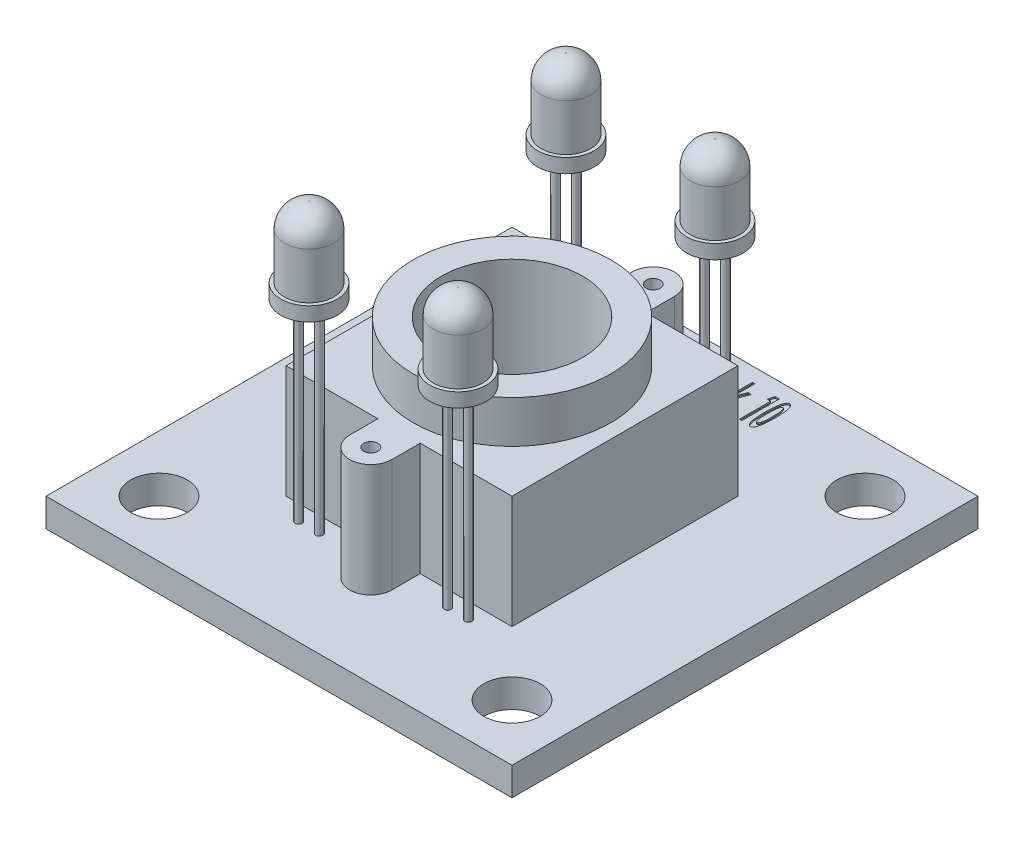
from build123d import *

# Parameters (mm, degrees)
SKETCH1_W            = 33
SKETCH1_H            = 33
BOSS_EXTRUDE1_DEPTH  = 2
SKETCH2_R            = 2
CUT_EXTRUDE1_DEPTH   = 2
BOSS_EXTRUDE2_DEPTH  = 8
SKETCH8_R            = 0.5
CUT_EXTRUDE2_DEPTH   = 5
SKETCH9_R            = 0.25
BOSS_EXTRUDE3_DEPTH  = 14
SKETCH13_R           = 2
BOSS_EXTRUDE6_DEPTH  = 1
SKETCH25_R           = 1.75
BOSS_EXTRUDE7_DEPTH  = 5
FILLET4_R            = 1.7
SKETCH26_R           = 1.75
BOSS_EXTRUDE8_DEPTH  = 5
FILLET5_R            = 1.7
SKETCH27_R           = 1.75
BOSS_EXTRUDE9_DEPTH  = 5
FILLET6_R            = 1.7
SKETCH28_R           = 1.75
BOSS_EXTRUDE10_DEPTH = 5
FILLET7_R            = 1.7
SKETCH29_R           = 7
BOSS_EXTRUDE11_DEPTH = 3
SKETCH30_R           = 5
CUT_EXTRUDE4_DEPTH   = 9
SKETCH31_W           = 0.169604701
SKETCH31_H           = 2.713675214
SKETCH31_W_2         = 0.712339743
SKETCH31_H_2         = 0.169604701
CUT_EXTRUDE5_DEPTH   = 0.1


with BuildPart() as part:
    # Sketch1 → Boss-Extrude1 (new body)
    with BuildSketch(Plane(origin=(0, 0, 0), x_dir=(1, 0, 0), z_dir=(0, 1, 0))):
        with Locations((-19.54163097, 23.680254944)):
            Rectangle(SKETCH1_W, SKETCH1_H)
    extrude(amount=BOSS_EXTRUDE1_DEPTH)

    # Sketch2 → Cut-Extrude1 (cut)
    with BuildSketch(Plane(origin=(0, 2, 0), x_dir=(1, 0, 0), z_dir=(0, 1, 0))):
        with Locations(Location((-32.04163097, 36.180254944, 0), (0, 0, 270))):
            Circle(SKETCH2_R)
        with Locations(Location((-7.04163097, 36.180254944, 0), (0, 0, 270))):
            Circle(SKETCH2_R)
        with Locations(Location((-7.04163097, 11.180254944, 0), (0, 0, 270))):
            Circle(SKETCH2_R)
        with Locations(Location((-32.04163097, 11.180254944, 0), (0, 0, 270))):
            Circle(SKETCH2_R)
    extrude(amount=-CUT_EXTRUDE1_DEPTH, mode=Mode.SUBTRACT)

    # Sketch7 → Boss-Extrude2 (add)
    with BuildSketch(Plane(origin=(0, 2, 0), x_dir=(1, 0, 0), z_dir=(0, 1, 0))):
        with BuildLine():
            Line((-21.04163097, 15.680254944), (-21.04163097, 13.680254944))
            ThreePointArc((-21.04163097, 13.680254944), (-19.54163097, 12.180254944), (-18.04163097, 13.680254944))
            Line((-18.04163097, 13.680254944), (-18.04163097, 15.680254944))
            Line((-18.04163097, 15.680254944), (-11.54163097, 15.680254944))
            Line((-11.54163097, 15.680254944), (-11.54163097, 31.680254944))
            Line((-11.54163097, 31.680254944), (-18.04163097, 31.680254944))
            Line((-18.04163097, 31.680254944), (-18.04163097, 33.680254944))
            ThreePointArc((-18.04163097, 33.680254944), (-19.54163097, 35.180254944), (-21.04163097, 33.680254944))
            Line((-21.04163097, 33.680254944), (-21.04163097, 31.680254944))
            Line((-21.04163097, 31.680254944), (-27.54163097, 31.680254944))
            Line((-27.54163097, 31.680254944), (-27.54163097, 15.680254944))
            Line((-27.54163097, 15.680254944), (-21.04163097, 15.680254944))
        make_face()
    extrude(amount=BOSS_EXTRUDE2_DEPTH)

    # Sketch8 → Cut-Extrude2 (cut)
    with BuildSketch(Plane(origin=(0, 10, 0), x_dir=(1, 0, 0), z_dir=(0, 1, 0))):
        with Locations(Location((-19.54163097, 33.680254944, 0), (0, 0, 270))):
            Circle(SKETCH8_R)
        with Locations(Location((-19.54163097, 13.680254944, 0), (0, 0, 270))):
            Circle(SKETCH8_R)
    extrude(amount=-CUT_EXTRUDE2_DEPTH, mode=Mode.SUBTRACT)

    # Sketch9 → Boss-Extrude3 (add)
    with BuildSketch(Plane(origin=(0, 2, 0), x_dir=(1, 0, 0), z_dir=(0, 1, 0))):
        with Locations(Location((-25.551424168, 32.777236542, 0), (0, 0, 270))):
            Circle(SKETCH9_R)
        with Locations(Location((-24.084586125, 32.777236542, 0), (0, 0, 270))):
            Circle(SKETCH9_R)
        with Locations(Location((-14.998675815, 32.777236542, 0), (0, 0, 90))):
            Circle(SKETCH9_R)
        with Locations(Location((-13.531837771, 32.777236542, 0), (0, 0, 90))):
            Circle(SKETCH9_R)
        with Locations(Location((-24.084586125, 14.583273346, 0), (0, 0, 90))):
            Circle(SKETCH9_R)
        with Locations(Location((-25.551424168, 14.583273346, 0), (0, 0, 90))):
            Circle(SKETCH9_R)
        with Locations(Location((-14.998675815, 14.583273346, 0), (0, 0, 270))):
            Circle(SKETCH9_R)
        with Locations(Location((-13.531837771, 14.583273346, 0), (0, 0, 270))):
            Circle(SKETCH9_R)
    extrude(amount=BOSS_EXTRUDE3_DEPTH)

    # Sketch13 → Boss-Extrude6 (add)
    with BuildSketch(Plane(origin=(0, 16, 0), x_dir=(1, 0, 0), z_dir=(0, 1, 0))):
        with Locations(Location((-14.265256793, 14.583273346, 0), (0, 0, 270))):
            Circle(SKETCH13_R)
        with Locations(Location((-24.818005146, 32.777236542, 0), (0, 0, 270))):
            Circle(SKETCH13_R)
        with Locations(Location((-24.818005146, 14.583273346, 0), (0, 0, 270))):
            Circle(SKETCH13_R)
        with Locations(Location((-14.265256793, 32.777236542, 0), (0, 0, 270))):
            Circle(SKETCH13_R)
    extrude(amount=BOSS_EXTRUDE6_DEPTH)

    # Sketch25 → Boss-Extrude7 (add)
    with BuildSketch(Plane(origin=(0, 17, 0), x_dir=(1, 0, 0), z_dir=(0, 1, 0))):
        with Locations(Location((-24.818005146, 32.777236542, 0), (0, 0, 270))):
            Circle(SKETCH25_R)
    extrude(amount=BOSS_EXTRUDE7_DEPTH)

    # Fillet4
    fillet4_edges = [part.edges().sort_by_distance(p)[0] for p in [
        (-24.818005146, 22, -34.527236542),
    ]]
    fillet(fillet4_edges, radius=FILLET4_R)

    # Sketch26 → Boss-Extrude8 (add)
    with BuildSketch(Plane(origin=(0, 17, 0), x_dir=(1, 0, 0), z_dir=(0, 1, 0))):
        with Locations(Location((-14.265256793, 32.777236542, 0), (0, 0, 270))):
            Circle(SKETCH26_R)
    extrude(amount=BOSS_EXTRUDE8_DEPTH)

    # Fillet5
    fillet5_edges = [part.edges().sort_by_distance(p)[0] for p in [
        (-14.265256793, 22, -34.527236542),
    ]]
    fillet(fillet5_edges, radius=FILLET5_R)

    # Sketch27 → Boss-Extrude9 (add)
    with BuildSketch(Plane(origin=(0, 17, 0), x_dir=(1, 0, 0), z_dir=(0, 1, 0))):
        with Locations(Location((-24.818005146, 14.583273346, 0), (0, 0, 270))):
            Circle(SKETCH27_R)
    extrude(amount=BOSS_EXTRUDE9_DEPTH)

    # Fillet6
    fillet6_edges = [part.edges().sort_by_distance(p)[0] for p in [
        (-24.818005146, 22, -16.333273346),
    ]]
    fillet(fillet6_edges, radius=FILLET6_R)

    # Sketch28 → Boss-Extrude10 (add)
    with BuildSketch(Plane(origin=(0, 17, 0), x_dir=(1, 0, 0), z_dir=(0, 1, 0))):
        with Locations(Location((-14.265256793, 14.583273346, 0), (0, 0, 270))):
            Circle(SKETCH28_R)
    extrude(amount=BOSS_EXTRUDE10_DEPTH)

    # Fillet7
    fillet7_edges = [part.edges().sort_by_distance(p)[0] for p in [
        (-14.265256793, 22, -16.333273346),
    ]]
    fillet(fillet7_edges, radius=FILLET7_R)

    # Sketch29 → Boss-Extrude11 (add)
    with BuildSketch(Plane(origin=(0, 10, 0), x_dir=(1, 0, 0), z_dir=(0, 1, 0))):
        with Locations(Location((-19.54163097, 23.680254944, 0), (0, 0, 270))):
            Circle(SKETCH29_R)
    extrude(amount=BOSS_EXTRUDE11_DEPTH)

    # Sketch30 → Cut-Extrude4 (cut)
    with BuildSketch(Plane(origin=(0, 13, 0), x_dir=(1, 0, 0), z_dir=(0, 1, 0))):
        with Locations(Location((-19.54163097, 23.680254944, 0), (0, 0, 270))):
            Circle(SKETCH30_R)
    extrude(amount=-CUT_EXTRUDE4_DEPTH, mode=Mode.SUBTRACT)

    # Sketch31 → Cut-Extrude5 (cut)
    # profile 1 of 11: a face of its own
    with BuildSketch(Plane(origin=(0, 2, 0), x_dir=(1, 0, 0), z_dir=(0, 1, 0))):
        Polygon((-24.04613608, 39.175718338), (-23.876531379, 39.175718338), (-23.876531379, 37.593094473), (-23.577603094, 38.395536714), (-23.339626498, 38.395536714), (-23.683076018, 37.474371182), (-23.289805117, 36.462043124), (-23.532551846, 36.462043124), (-23.876531379, 37.347697672), (-23.876531379, 36.462043124), (-24.04613608, 36.462043124), align=None)
    # profile 2 of 11: a face of its own
    with BuildSketch(Plane(origin=(0, 2, 0), x_dir=(1, 0, 0), z_dir=(0, 1, 0))):
        with BuildLine():
            Line((-22.486302847, 37.310066629), (-23.062428815, 37.310066629))
            add(Edge.make_bspline(
                [(-23.062428815, 37.310066629), (-23.060092807, 37.275566817), (-23.055656278, 37.210045031), (-23.041792742, 37.117599898), (-23.023691788, 37.03611063), (-23.003959215, 36.975813621), (-22.985967642, 36.9340204), (-22.971722679, 36.907841315), (-22.956259508, 36.885756492), (-22.939771248, 36.867712593), (-22.922831665, 36.852894315), (-22.904460821, 36.842553504), (-22.885065264, 36.836550051), (-22.871838812, 36.835630578), (-22.865263351, 36.835173466)],
                knots=[0, 0, 0, 0, 2.26240371, 4.29674037, 6.1116121, 7.72051985, 8.440231073, 9.08715116, 9.667850066, 10.199883465, 10.684021747, 11.134393618, 11.569668285, 12, 12, 12, 12], degree=3))
            add(Edge.make_bspline(
                [(-22.865263351, 36.835173466), (-22.857206387, 36.835776068), (-22.840876438, 36.836997427), (-22.817533593, 36.84766052), (-22.794698943, 36.863201495), (-22.773813602, 36.886126319), (-22.75358051, 36.91469826), (-22.734040172, 36.949319828), (-22.715642363, 36.990429961), (-22.704657619, 37.020251729), (-22.698838738, 37.036049034)],
                knots=[0, 0, 0, 0, 0.69720684, 1.413107077, 2.196945426, 3.087684772, 4.089229467, 5.237869303, 6.536833292, 8, 8, 8, 8], degree=3))
            Line((-22.698838738, 37.036049034), (-22.553614713, 36.846833789))
            add(Edge.make_bspline(
                [(-22.553614713, 36.846833789), (-22.562722579, 36.813493895), (-22.57990217, 36.750606962), (-22.61060133, 36.663916506), (-22.645098294, 36.591398587), (-22.68115505, 36.531762093), (-22.721644371, 36.485770012), (-22.765462381, 36.452359064), (-22.814097156, 36.43160792), (-22.848109359, 36.429290813), (-22.865263351, 36.428122184)],
                knots=[0, 0, 0, 0, 1.48158854, 2.794626752, 3.936371042, 4.919921831, 5.772888142, 6.547010034, 7.267187192, 8, 8, 8, 8], degree=3))
            add(Edge.make_bspline(
                [(-22.865263351, 36.428122184), (-22.878630804, 36.428879403), (-22.905338661, 36.430392307), (-22.944065547, 36.444733086), (-22.980403295, 36.467488692), (-23.014763517, 36.498974886), (-23.046513531, 36.539547084), (-23.076443229, 36.588648789), (-23.105155837, 36.646204807), (-23.130972191, 36.711979939), (-23.154695872, 36.784181635), (-23.1750863, 36.861790812), (-23.193260279, 36.943575192), (-23.207386902, 37.029955309), (-23.218497573, 37.12066369), (-23.226293525, 37.215966841), (-23.2311694, 37.315668843), (-23.231741602, 37.383556211), (-23.232033516, 37.418189625)],
                knots=[0, 0, 0, 0, 0.566036267, 1.130927163, 1.730730317, 2.378910434, 3.099701638, 3.911896734, 4.818057079, 5.828391848, 6.910561401, 8.044646951, 9.235512626, 10.468023947, 11.760947572, 13.116453906, 14.528930372, 16, 16, 16, 16], degree=3))
            add(Edge.make_bspline(
                [(-23.232033516, 37.418189625), (-23.23172548, 37.453705132), (-23.231121379, 37.523355851), (-23.226481128, 37.625384819), (-23.217952809, 37.722791399), (-23.206142032, 37.815558253), (-23.192324854, 37.903939418), (-23.174249572, 37.987639325), (-23.152355585, 38.066394531), (-23.128566089, 38.140221425), (-23.101629664, 38.207057326), (-23.073676641, 38.266232871), (-23.04273398, 38.315761355), (-23.010907481, 38.35697198), (-22.977172027, 38.38927881), (-22.941213847, 38.412272948), (-22.903507422, 38.427252694), (-22.877231622, 38.428726767), (-22.864203321, 38.429457654)],
                knots=[0, 0, 0, 0, 1.484372448, 2.911055342, 4.267503423, 5.569894718, 6.819054804, 8.005234241, 9.146360781, 10.234509803, 11.245082005, 12.156564207, 12.965891522, 13.680893525, 14.328678676, 14.90634117, 15.457732384, 16, 16, 16, 16], degree=3))
            add(Edge.make_bspline(
                [(-22.864203321, 38.429457654), (-22.850492886, 38.428678388), (-22.82294903, 38.427112864), (-22.782918044, 38.413017953), (-22.745390134, 38.390131756), (-22.709757532, 38.358511601), (-22.676905947, 38.317844104), (-22.645200087, 38.268948187), (-22.61654893, 38.210936891), (-22.589880508, 38.144729409), (-22.565068288, 38.071746755), (-22.544069552, 37.992346072), (-22.52609941, 37.907428465), (-22.511413276, 37.816854486), (-22.499827356, 37.72066327), (-22.491310517, 37.618843223), (-22.486667269, 37.511163128), (-22.486076089, 37.437451083), (-22.485772832, 37.399639111)],
                knots=[0, 0, 0, 0, 0.558103449, 1.121213242, 1.709731664, 2.343165441, 3.054843356, 3.836710845, 4.716894149, 5.69017516, 6.748002001, 7.860220642, 9.039463247, 10.288669287, 11.603154595, 12.992136382, 14.457060095, 16, 16, 16, 16], degree=3))
            Line((-22.485772832, 37.399639111), (-22.486302847, 37.310066629))
        make_face()
        with BuildLine():
            add(Edge.make_bspline(
                [(-22.655377533, 37.68319697), (-22.658903454, 37.707109945), (-22.665693001, 37.753157002), (-22.681206617, 37.818283362), (-22.702070773, 37.876389659), (-22.72685729, 37.926772619), (-22.754943974, 37.968191808), (-22.785221751, 37.999484282), (-22.819518461, 38.018867655), (-22.84385152, 38.02124602), (-22.855723086, 38.022406372)],
                knots=[0, 0, 0, 0, 1.372158236, 2.642241297, 3.794152432, 4.870878305, 5.822578512, 6.624181561, 7.328768303, 8, 8, 8, 8], degree=3))
            add(Edge.make_bspline(
                [(-22.855723086, 38.022406372), (-22.868734242, 38.021240885), (-22.895475412, 38.018845517), (-22.932116093, 37.995815099), (-22.96638023, 37.962048833), (-22.983963738, 37.93248329), (-22.993526906, 37.916403434)],
                knots=[0, 0, 0, 0, 0.849239474, 1.74539882, 2.773786763, 4, 4, 4, 4], degree=3))
            add(Edge.make_bspline(
                [(-22.993526906, 37.916403434), (-22.999823173, 37.903448432), (-23.014114296, 37.874043465), (-23.03063108, 37.821487998), (-23.047607666, 37.756764749), (-23.057219353, 37.70905519), (-23.062428815, 37.68319697)],
                knots=[0, 0, 0, 0, 0.707801204, 1.606551035, 2.702768784, 4, 4, 4, 4], degree=3))
            Line((-23.062428815, 37.68319697), (-22.655377533, 37.68319697))
        make_face(mode=Mode.SUBTRACT)
    # profile 3 of 11: a face of its own
    with BuildSketch(Plane(origin=(0, 2, 0), x_dir=(1, 0, 0), z_dir=(0, 1, 0))):
        with Locations((-22.265286722, 37.818880731)):
            Rectangle(SKETCH31_W, SKETCH31_H)
    # profile 4 of 11: a face of its own
    with BuildSketch(Plane(origin=(0, 2, 0), x_dir=(1, 0, 0), z_dir=(0, 1, 0))):
        with BuildLine():
            add(Edge.make_bspline(
                [(-21.641989446, 38.429457654), (-21.633651288, 38.429029199), (-21.616738488, 38.428160138), (-21.591767593, 38.42164212), (-21.567589294, 38.410530112), (-21.543330699, 38.396121788), (-21.519619077, 38.377030502), (-21.497002186, 38.353172414), (-21.473797396, 38.326132511), (-21.443925751, 38.282489424), (-21.408088817, 38.219831847), (-21.371185505, 38.133924216), (-21.339969237, 38.035753479), (-21.312702063, 37.9272699), (-21.291559871, 37.810352352), (-21.275377645, 37.687816237), (-21.266578589, 37.560540569), (-21.265278811, 37.474206812), (-21.264618986, 37.430379963)],
                knots=[0, 0, 0, 0, 0.351783623, 0.71354448, 1.080798435, 1.472172982, 1.901951841, 2.36077312, 2.858270291, 3.40447444, 4.590358111, 5.899642449, 7.342991291, 8.934720193, 10.618350071, 12.355568816, 14.149924909, 16, 16, 16, 16], degree=3))
            add(Edge.make_bspline(
                [(-21.264618986, 37.430379963), (-21.26519462, 37.386192263), (-21.266328845, 37.299125059), (-21.276333941, 37.170909778), (-21.291206521, 37.046771122), (-21.313519594, 36.928686133), (-21.339717782, 36.818733114), (-21.371065579, 36.720306183), (-21.407757356, 36.634813183), (-21.442087808, 36.572345522), (-21.472009551, 36.529620836), (-21.494686361, 36.502806362), (-21.517491359, 36.479646322), (-21.540983428, 36.46068219), (-21.565358274, 36.446381792), (-21.590321816, 36.436066966), (-21.615670073, 36.429381074), (-21.632940264, 36.428538041), (-21.641459431, 36.428122184)],
                knots=[0, 0, 0, 0, 1.857588962, 3.660183185, 5.404312046, 7.111832744, 8.70988373, 10.154571648, 11.448894468, 12.616283115, 13.143895714, 13.639419582, 14.091138236, 14.508773172, 14.904983423, 15.274681827, 15.642209698, 16, 16, 16, 16], degree=3))
            add(Edge.make_bspline(
                [(-21.641459431, 36.428122184), (-21.654115905, 36.429121913), (-21.679584802, 36.431133688), (-21.716864388, 36.445339577), (-21.752093079, 36.468807776), (-21.785668599, 36.501342459), (-21.817531372, 36.542971037), (-21.847869466, 36.593435966), (-21.87716933, 36.652798862), (-21.903889753, 36.720542445), (-21.929347273, 36.794510381), (-21.950750792, 36.873579151), (-21.969281011, 36.956345986), (-21.984804763, 37.042958622), (-21.996187192, 37.133564001), (-22.004588755, 37.227967368), (-22.010160641, 37.326253539), (-22.010636741, 37.393094454), (-22.01087967, 37.427199875)],
                knots=[0, 0, 0, 0, 0.535083914, 1.076760913, 1.665703556, 2.316164704, 3.046001528, 3.878187201, 4.804376385, 5.844264167, 6.95787084, 8.113284387, 9.308623219, 10.546440741, 11.835470786, 13.17166493, 14.556848658, 16, 16, 16, 16], degree=3))
            add(Edge.make_bspline(
                [(-22.01087967, 37.427199875), (-22.010392679, 37.463599639), (-22.009439462, 37.534847135), (-22.004332218, 37.639367959), (-21.994922341, 37.739319321), (-21.980874746, 37.834543866), (-21.964401684, 37.925452626), (-21.94297813, 38.011359), (-21.918367166, 38.092887219), (-21.898306739, 38.14477544), (-21.888446277, 38.170280471)],
                knots=[0, 0, 0, 0, 1.152955905, 2.256751495, 3.313576302, 4.331277093, 5.304772617, 6.238520075, 7.134165746, 8, 8, 8, 8], degree=3))
            add(Edge.make_bspline(
                [(-21.888446277, 38.170280471), (-21.879807612, 38.190774437), (-21.86342516, 38.229639402), (-21.834451734, 38.282151606), (-21.805536648, 38.327195255), (-21.775502981, 38.364250177), (-21.743919582, 38.393031678), (-21.711184109, 38.41370196), (-21.677042318, 38.426852657), (-21.653580717, 38.428596235), (-21.641989446, 38.429457654)],
                knots=[0, 0, 0, 0, 1.413084553, 2.679787858, 3.807593793, 4.81290107, 5.703757852, 6.51102584, 7.264368036, 8, 8, 8, 8], degree=3))
        make_face()
        with BuildLine():
            add(Edge.make_bspline(
                [(-21.638279343, 37.988485432), (-21.645380036, 37.987859743), (-21.659722045, 37.986595974), (-21.681051241, 37.979831296), (-21.700097938, 37.966079667), (-21.719146601, 37.948955857), (-21.736725267, 37.926488521), (-21.754148326, 37.899537498), (-21.769462391, 37.86725726), (-21.789890214, 37.81689487), (-21.811198776, 37.745454392), (-21.82887072, 37.650433629), (-21.839256446, 37.544563098), (-21.840580995, 37.470332056), (-21.841274969, 37.431439993)],
                knots=[0, 0, 0, 0, 0.404997363, 0.818015255, 1.25270404, 1.729157232, 2.272053604, 2.868461607, 3.551418822, 4.299547476, 5.958569517, 7.779222124, 9.78859686, 12, 12, 12, 12], degree=3))
            add(Edge.make_bspline(
                [(-21.841274969, 37.431439993), (-21.840586679, 37.391488097), (-21.839277449, 37.315493747), (-21.828905938, 37.207332454), (-21.811280315, 37.111097857), (-21.790286352, 37.039128023), (-21.770372521, 36.988877887), (-21.75406075, 36.957454989), (-21.738248046, 36.929936076), (-21.71992535, 36.908178596), (-21.701311409, 36.890651324), (-21.681615158, 36.878124531), (-21.660502381, 36.870789249), (-21.646107603, 36.869664607), (-21.638809358, 36.869094406)],
                knots=[0, 0, 0, 0, 2.25141265, 4.282516271, 6.116295955, 7.757668769, 8.499131312, 9.158191485, 9.752463663, 10.282820424, 10.755028238, 11.188825239, 11.588729125, 12, 12, 12, 12], degree=3))
            add(Edge.make_bspline(
                [(-21.638809358, 36.869094406), (-21.631500683, 36.869635625), (-21.61685981, 36.870719805), (-21.595707064, 36.878662495), (-21.575788038, 36.891160231), (-21.556958863, 36.90873256), (-21.539102498, 36.931123869), (-21.522214443, 36.958415354), (-21.506266054, 36.990530329), (-21.486341101, 37.041318806), (-21.464771888, 37.113546984), (-21.446527935, 37.209580517), (-21.436263778, 37.316910112), (-21.434925871, 37.392019659), (-21.434223687, 37.431439993)],
                knots=[0, 0, 0, 0, 0.4109853, 0.823293454, 1.256789239, 1.728669166, 2.266354513, 2.865442734, 3.532930073, 4.283107185, 5.935728195, 7.770097615, 9.779987105, 12, 12, 12, 12], degree=3))
            add(Edge.make_bspline(
                [(-21.434223687, 37.431439993), (-21.434912168, 37.470860866), (-21.436220896, 37.545795626), (-21.446587727, 37.652564838), (-21.464374018, 37.747665666), (-21.484950651, 37.819119111), (-21.505493349, 37.868865488), (-21.520943813, 37.900713745), (-21.538130024, 37.927320366), (-21.555488213, 37.949808921), (-21.574732827, 37.966709821), (-21.594639427, 37.979762117), (-21.616299702, 37.986625264), (-21.630997209, 37.987869135), (-21.638279343, 37.988485432)],
                knots=[0, 0, 0, 0, 2.235004479, 4.248498566, 6.07369283, 7.715403084, 8.452081622, 9.124076453, 9.718748639, 10.245977967, 10.728485023, 11.164908173, 11.586239346, 12, 12, 12, 12], degree=3))
        make_face(mode=Mode.SUBTRACT)
    # profile 5 of 11: a face of its own
    with BuildSketch(Plane(origin=(0, 2, 0), x_dir=(1, 0, 0), z_dir=(0, 1, 0))):
        with BuildLine():
            Line((-21.128935226, 38.395536714), (-20.959330525, 38.395536714))
            Line((-20.959330525, 38.395536714), (-20.959330525, 38.164450309))
            add(Edge.make_bspline(
                [(-20.959330525, 38.164450309), (-20.951546349, 38.185440294), (-20.936807125, 38.225184531), (-20.910699437, 38.279324195), (-20.883975771, 38.325515126), (-20.855362571, 38.363010198), (-20.825389994, 38.392507442), (-20.793902423, 38.413707139), (-20.760500122, 38.426896184), (-20.737541799, 38.428606882), (-20.726124061, 38.429457654)],
                knots=[0, 0, 0, 0, 1.434282653, 2.715793702, 3.848109092, 4.849318309, 5.730330714, 6.531278873, 7.269568945, 8, 8, 8, 8], degree=3))
            add(Edge.make_bspline(
                [(-20.726124061, 38.429457654), (-20.714622104, 38.428435166), (-20.69097033, 38.426332596), (-20.657524555, 38.408102786), (-20.626993624, 38.379294905), (-20.598740191, 38.339974663), (-20.572386911, 38.290529779), (-20.548178226, 38.231295958), (-20.527865021, 38.161509626), (-20.51681314, 38.111521288), (-20.510938097, 38.084948106)],
                knots=[0, 0, 0, 0, 0.634519665, 1.304779277, 2.06055909, 2.950011418, 3.975691353, 5.161717685, 6.491204234, 8, 8, 8, 8], degree=3))
            add(Edge.make_bspline(
                [(-20.510938097, 38.084948106), (-20.503589343, 38.111583149), (-20.489709455, 38.161889829), (-20.463523624, 38.231339515), (-20.435402452, 38.290875639), (-20.404599428, 38.340256372), (-20.372091014, 38.379939959), (-20.336842263, 38.407910116), (-20.299902153, 38.426512703), (-20.274042397, 38.428485599), (-20.261301178, 38.429457654)],
                knots=[0, 0, 0, 0, 1.464927975, 2.766868424, 3.932083135, 4.951277168, 5.848823572, 6.636238357, 7.328068477, 8, 8, 8, 8], degree=3))
            add(Edge.make_bspline(
                [(-20.261301178, 38.429457654), (-20.248180813, 38.428375217), (-20.221548699, 38.426178053), (-20.18424946, 38.406117011), (-20.150206652, 38.375185089), (-20.119951379, 38.332942878), (-20.091766327, 38.282229275), (-20.069207794, 38.222898376), (-20.049168154, 38.156972966), (-20.037579195, 38.096301393), (-20.029095842, 38.042322572), (-20.0238635, 37.994923215), (-20.020098642, 37.941495806), (-20.015284087, 37.882194114), (-20.013207359, 37.816765643), (-20.010803214, 37.74540151), (-20.0099921, 37.668004447), (-20.009697067, 37.614471505), (-20.0095442, 37.586734297)],
                knots=[0, 0, 0, 0, 0.665353899, 1.350555509, 2.11024566, 2.998898767, 3.987217433, 5.063356828, 6.22962126, 7.498715609, 8.209976218, 9.017153097, 9.930285874, 10.942278983, 12.051755455, 13.269002634, 14.584978896, 16, 16, 16, 16], degree=3))
            Line((-20.0095442, 37.586734297), (-20.0095442, 36.462043124))
            Line((-20.0095442, 36.462043124), (-20.179148901, 36.462043124))
            Line((-20.179148901, 36.462043124), (-20.179148901, 37.433030037))
            add(Edge.make_bspline(
                [(-20.179148901, 37.433030037), (-20.17924293, 37.459001548), (-20.179423332, 37.508829782), (-20.18098953, 37.580217682), (-20.183601163, 37.645068935), (-20.187155422, 37.703402913), (-20.192069508, 37.755153135), (-20.19694772, 37.800508849), (-20.203722742, 37.839110766), (-20.213856101, 37.879779694), (-20.228144868, 37.920889415), (-20.250635374, 37.958719682), (-20.279706789, 37.983878189), (-20.302254447, 37.986975847), (-20.313242617, 37.988485432)],
                knots=[0, 0, 0, 0, 1.542182938, 2.958790272, 4.239742012, 5.39606398, 6.42848853, 7.326356182, 8.104233088, 8.75305309, 9.815165403, 10.67368193, 11.353644256, 12, 12, 12, 12], degree=3))
            add(Edge.make_bspline(
                [(-20.313242617, 37.988485432), (-20.321727995, 37.987682438), (-20.339220292, 37.986027096), (-20.363565294, 37.970886844), (-20.385737134, 37.947854591), (-20.406596766, 37.91689062), (-20.425624258, 37.878648741), (-20.441020594, 37.83302542), (-20.454898013, 37.781013734), (-20.463661775, 37.732648606), (-20.470166003, 37.689136522), (-20.473335112, 37.651043418), (-20.477520429, 37.608351545), (-20.479780801, 37.560950794), (-20.481954068, 37.508659145), (-20.483670242, 37.451767867), (-20.483851714, 37.390097918), (-20.484237346, 37.347520647), (-20.484437362, 37.325437055)],
                knots=[0, 0, 0, 0, 0.558149775, 1.150605397, 1.845974395, 2.670809094, 3.613216172, 4.668484055, 5.855475513, 7.178020355, 7.923058567, 8.769947394, 9.710097555, 10.765365439, 11.913621039, 13.178480515, 14.536559917, 16, 16, 16, 16], degree=3))
            Line((-20.484437362, 37.325437055), (-20.484437362, 36.462043124))
            Line((-20.484437362, 36.462043124), (-20.654042063, 36.462043124))
            Line((-20.654042063, 36.462043124), (-20.654042063, 37.389038817))
            add(Edge.make_bspline(
                [(-20.654042063, 37.389038817), (-20.653933539, 37.409710433), (-20.65372482, 37.449466811), (-20.655162853, 37.506878058), (-20.655976058, 37.559889137), (-20.657596437, 37.608654719), (-20.659640774, 37.653009374), (-20.662293733, 37.692944198), (-20.665334977, 37.728305734), (-20.670285925, 37.768451621), (-20.676878981, 37.812485442), (-20.687295134, 37.859325893), (-20.699768752, 37.898836364), (-20.714320104, 37.931119354), (-20.731111487, 37.955881637), (-20.748206608, 37.975194217), (-20.769105074, 37.986032991), (-20.783616914, 37.987674511), (-20.790785853, 37.988485432)],
                knots=[0, 0, 0, 0, 1.52867596, 2.940003396, 4.246825332, 5.449500038, 6.548254622, 7.530350296, 8.409249085, 9.172553401, 10.521541681, 11.700635755, 12.717069403, 13.582166485, 14.306924993, 14.925992125, 15.469433406, 16, 16, 16, 16], degree=3))
            add(Edge.make_bspline(
                [(-20.790785853, 37.988485432), (-20.798936114, 37.987688209), (-20.81604689, 37.986014506), (-20.839361054, 37.970186462), (-20.861324365, 37.947256391), (-20.881628054, 37.915629116), (-20.899714672, 37.876254052), (-20.916220451, 37.829822311), (-20.929672782, 37.776192495), (-20.938601912, 37.726470226), (-20.94500339, 37.681883231), (-20.948293952, 37.642746124), (-20.952350002, 37.599158136), (-20.954686888, 37.550881612), (-20.956841964, 37.498058299), (-20.958564466, 37.440637579), (-20.958744433, 37.37843757), (-20.959130396, 37.335506972), (-20.959330525, 37.313246717)],
                knots=[0, 0, 0, 0, 0.528266197, 1.109049727, 1.787437817, 2.604876988, 3.551012645, 4.618488639, 5.823908008, 7.163691924, 7.922130849, 8.769736806, 9.732458479, 10.78582513, 11.931003132, 13.191304851, 14.54364308, 16, 16, 16, 16], degree=3))
            Line((-20.959330525, 37.313246717), (-20.959330525, 36.462043124))
            Line((-20.959330525, 36.462043124), (-21.128935226, 36.462043124))
            Line((-21.128935226, 36.462043124), (-21.128935226, 38.395536714))
        make_face()
    # profile 6 of 11: a face of its own
    with BuildSketch(Plane(origin=(0, 2, 0), x_dir=(1, 0, 0), z_dir=(0, 1, 0))):
        with BuildLine():
            Line((-19.636413858, 38.395536714), (-19.636413858, 38.177700676))
            add(Edge.make_bspline(
                [(-19.636413858, 38.177700676), (-19.627752952, 38.197660837), (-19.611374642, 38.235406737), (-19.582757437, 38.286439016), (-19.554830532, 38.330590028), (-19.524151984, 38.365897472), (-19.492989223, 38.394220034), (-19.460049583, 38.414110394), (-19.426122461, 38.427547398), (-19.402618811, 38.428826346), (-19.391017057, 38.429457654)],
                knots=[0, 0, 0, 0, 1.405361809, 2.657626256, 3.778849327, 4.774720399, 5.672817637, 6.487545181, 7.2534296, 8, 8, 8, 8], degree=3))
            add(Edge.make_bspline(
                [(-19.391017057, 38.429457654), (-19.378536368, 38.428660451), (-19.353221712, 38.427043479), (-19.316361074, 38.412827765), (-19.281582803, 38.389705704), (-19.247798284, 38.35863841), (-19.216893281, 38.317913882), (-19.186465323, 38.269443774), (-19.158240125, 38.211654611), (-19.131008821, 38.146220708), (-19.106371909, 38.073777097), (-19.084486032, 37.995806198), (-19.067070593, 37.912633842), (-19.051283382, 37.824885563), (-19.039759161, 37.731993772), (-19.032295989, 37.633995224), (-19.026500366, 37.531150675), (-19.026061307, 37.460952992), (-19.025836935, 37.425079816)],
                knots=[0, 0, 0, 0, 0.524383652, 1.063610545, 1.639594538, 2.276938829, 2.987165668, 3.786351749, 4.685046115, 5.69267972, 6.770671125, 7.906513329, 9.102111354, 10.348988078, 11.661720716, 13.043147495, 14.488957377, 16, 16, 16, 16], degree=3))
            add(Edge.make_bspline(
                [(-19.025836935, 37.425079816), (-19.026078879, 37.390443924), (-19.026554425, 37.322366334), (-19.032157634, 37.222499337), (-19.040244871, 37.126967684), (-19.052720491, 37.035956756), (-19.067733723, 36.949020709), (-19.086902644, 36.866458022), (-19.10900159, 36.788144217), (-19.134713252, 36.715290125), (-19.162592585, 36.648977838), (-19.191099487, 36.590359753), (-19.222166881, 36.541207361), (-19.253662605, 36.500240429), (-19.287198638, 36.468305173), (-19.322215351, 36.445600303), (-19.358539185, 36.430307289), (-19.383808112, 36.428845718), (-19.396317203, 36.428122184)],
                knots=[0, 0, 0, 0, 1.46783093, 2.88505314, 4.238217625, 5.530205727, 6.777298723, 7.976136291, 9.120927607, 10.224546183, 11.248111703, 12.169020854, 12.983396458, 13.708463052, 14.354782513, 14.934272924, 15.472424058, 16, 16, 16, 16], degree=3))
            add(Edge.make_bspline(
                [(-19.396317203, 36.428122184), (-19.407371316, 36.428829942), (-19.429687703, 36.430258787), (-19.462030937, 36.44236955), (-19.493470966, 36.460697661), (-19.523504573, 36.487462918), (-19.552076929, 36.523026087), (-19.581365493, 36.566619535), (-19.609736374, 36.620108957), (-19.627137237, 36.659440846), (-19.636413858, 36.680409177)],
                knots=[0, 0, 0, 0, 0.71896486, 1.45146867, 2.226170676, 3.083608671, 4.057353085, 5.195099558, 6.50467186, 8, 8, 8, 8], degree=3))
            Line((-19.636413858, 36.680409177), (-19.636413858, 35.749703381))
            Line((-19.636413858, 35.749703381), (-19.806018559, 35.749703381))
            Line((-19.806018559, 35.749703381), (-19.806018559, 38.395536714))
            Line((-19.806018559, 38.395536714), (-19.636413858, 38.395536714))
        make_face()
        with BuildLine():
            add(Edge.make_bspline(
                [(-19.414867718, 37.988485432), (-19.42268128, 37.987887921), (-19.438252422, 37.986697181), (-19.461238955, 37.97969759), (-19.482446489, 37.966762838), (-19.503635842, 37.950487207), (-19.522412766, 37.927901539), (-19.541184284, 37.901596564), (-19.557785813, 37.869736713), (-19.580426454, 37.820576502), (-19.603317112, 37.749690522), (-19.622525887, 37.654772782), (-19.634830711, 37.548362547), (-19.635869982, 37.473347344), (-19.636413858, 37.434090066)],
                knots=[0, 0, 0, 0, 0.438685141, 0.874227154, 1.331317405, 1.824849062, 2.365358828, 2.969971528, 3.634879477, 4.375210104, 6.004196551, 7.795522933, 9.799694976, 12, 12, 12, 12], degree=3))
            add(Edge.make_bspline(
                [(-19.636413858, 37.434090066), (-19.635889784, 37.39394781), (-19.634891976, 37.317519265), (-19.622387122, 37.208851243), (-19.603437649, 37.111957989), (-19.580513721, 37.039462955), (-19.557756775, 36.989454389), (-19.54130876, 36.957165838), (-19.522468217, 36.930662706), (-19.503276049, 36.908243219), (-19.482803779, 36.89073297), (-19.46119908, 36.877930883), (-19.438262272, 36.870870643), (-19.422684571, 36.869687903), (-19.414867718, 36.869094406)],
                knots=[0, 0, 0, 0, 2.215457463, 4.218103502, 6.029846749, 7.661747802, 8.399660686, 9.063006633, 9.65838672, 10.190642743, 10.689012203, 11.139122551, 11.56801371, 12, 12, 12, 12], degree=3))
            add(Edge.make_bspline(
                [(-19.414867718, 36.869094406), (-19.407208758, 36.869634973), (-19.391884709, 36.870716539), (-19.369685462, 36.878632294), (-19.348481132, 36.891230476), (-19.32842873, 36.909017299), (-19.309338553, 36.931589058), (-19.291185772, 36.958968584), (-19.274577825, 36.991549978), (-19.252044621, 37.042257854), (-19.228334156, 37.114683033), (-19.20960758, 37.211174502), (-19.196967445, 37.318214275), (-19.195965814, 37.393238186), (-19.195441636, 37.432500022)],
                knots=[0, 0, 0, 0, 0.425108024, 0.85055618, 1.295178684, 1.789412098, 2.332631437, 2.934546354, 3.610991552, 4.362788174, 6.017957703, 7.832147221, 9.818861356, 12, 12, 12, 12], degree=3))
            add(Edge.make_bspline(
                [(-19.195441636, 37.432500022), (-19.196037871, 37.471400957), (-19.197176438, 37.545686026), (-19.208844519, 37.651581859), (-19.227855693, 37.74658574), (-19.251386685, 37.817609466), (-19.27285483, 37.86777515), (-19.289801302, 37.899728275), (-19.307540166, 37.927048284), (-19.327033524, 37.949103491), (-19.346959193, 37.967014153), (-19.368557915, 37.97962501), (-19.391467838, 37.98671511), (-19.407049084, 37.987893912), (-19.414867718, 37.988485432)],
                knots=[0, 0, 0, 0, 2.180523851, 4.163919593, 5.964961733, 7.603365415, 8.348723575, 9.022362765, 9.629572926, 10.17008805, 10.668669398, 11.125764179, 11.56131051, 12, 12, 12, 12], degree=3))
        make_face(mode=Mode.SUBTRACT)
    # profile 7 of 11: a face of its own
    with BuildSketch(Plane(origin=(0, 2, 0), x_dir=(1, 0, 0), z_dir=(0, 1, 0))):
        with BuildLine():
            add(Edge.make_bspline(
                [(-18.52126295, 38.429457654), (-18.512924793, 38.429029199), (-18.496011992, 38.428160138), (-18.471041098, 38.42164212), (-18.446862798, 38.410530112), (-18.422604204, 38.396121788), (-18.398892581, 38.377030502), (-18.37627569, 38.353172414), (-18.3530709, 38.326132511), (-18.323199255, 38.282489424), (-18.287362321, 38.219831847), (-18.250459009, 38.133924216), (-18.219242741, 38.035753479), (-18.191975567, 37.9272699), (-18.170833375, 37.810352352), (-18.154651149, 37.687816237), (-18.145852093, 37.560540569), (-18.144552315, 37.474206812), (-18.143892491, 37.430379963)],
                knots=[0, 0, 0, 0, 0.351783623, 0.71354448, 1.080798435, 1.472172982, 1.901951841, 2.36077312, 2.858270291, 3.40447444, 4.590358111, 5.899642449, 7.342991291, 8.934720193, 10.618350071, 12.355568816, 14.149924909, 16, 16, 16, 16], degree=3))
            add(Edge.make_bspline(
                [(-18.143892491, 37.430379963), (-18.144468124, 37.386192263), (-18.145602349, 37.299125059), (-18.155607445, 37.170909778), (-18.170480026, 37.046771122), (-18.192793098, 36.928686133), (-18.218991286, 36.818733114), (-18.250339083, 36.720306183), (-18.287030861, 36.634813183), (-18.321361313, 36.572345522), (-18.351283055, 36.529620836), (-18.373959865, 36.502806362), (-18.396764863, 36.479646322), (-18.420256932, 36.46068219), (-18.444631778, 36.446381792), (-18.46959532, 36.436066966), (-18.494943577, 36.429381074), (-18.512213768, 36.428538041), (-18.520732935, 36.428122184)],
                knots=[0, 0, 0, 0, 1.857588962, 3.660183185, 5.404312046, 7.111832744, 8.70988373, 10.154571648, 11.448894468, 12.616283115, 13.143895714, 13.639419582, 14.091138236, 14.508773172, 14.904983423, 15.274681827, 15.642209698, 16, 16, 16, 16], degree=3))
            add(Edge.make_bspline(
                [(-18.520732935, 36.428122184), (-18.53338941, 36.429121913), (-18.558858307, 36.431133688), (-18.596137893, 36.445339577), (-18.631366583, 36.468807776), (-18.664942103, 36.501342459), (-18.696804876, 36.542971037), (-18.727142971, 36.593435966), (-18.756442834, 36.652798862), (-18.783163257, 36.720542445), (-18.808620777, 36.794510381), (-18.830024296, 36.873579151), (-18.848554515, 36.956345986), (-18.864078268, 37.042958622), (-18.875460696, 37.133564001), (-18.883862259, 37.227967368), (-18.889434145, 37.326253539), (-18.889910245, 37.393094454), (-18.890153174, 37.427199875)],
                knots=[0, 0, 0, 0, 0.535083914, 1.076760913, 1.665703556, 2.316164704, 3.046001528, 3.878187201, 4.804376385, 5.844264167, 6.95787084, 8.113284387, 9.308623219, 10.546440741, 11.835470786, 13.17166493, 14.556848658, 16, 16, 16, 16], degree=3))
            add(Edge.make_bspline(
                [(-18.890153174, 37.427199875), (-18.889666184, 37.463599639), (-18.888712967, 37.534847135), (-18.883605722, 37.639367959), (-18.874195845, 37.739319321), (-18.86014825, 37.834543866), (-18.843675188, 37.925452626), (-18.822251634, 38.011359), (-18.797640671, 38.092887219), (-18.777580243, 38.14477544), (-18.767719781, 38.170280471)],
                knots=[0, 0, 0, 0, 1.152955905, 2.256751495, 3.313576302, 4.331277093, 5.304772617, 6.238520075, 7.134165746, 8, 8, 8, 8], degree=3))
            add(Edge.make_bspline(
                [(-18.767719781, 38.170280471), (-18.759081116, 38.190774437), (-18.742698664, 38.229639402), (-18.713725238, 38.282151606), (-18.684810152, 38.327195255), (-18.654776485, 38.364250177), (-18.623193086, 38.393031678), (-18.590457613, 38.41370196), (-18.556315822, 38.426852657), (-18.532854221, 38.428596235), (-18.52126295, 38.429457654)],
                knots=[0, 0, 0, 0, 1.413084553, 2.679787858, 3.807593793, 4.81290107, 5.703757852, 6.51102584, 7.264368036, 8, 8, 8, 8], degree=3))
        make_face()
        with BuildLine():
            add(Edge.make_bspline(
                [(-18.517552847, 37.988485432), (-18.524653541, 37.987859743), (-18.538995549, 37.986595974), (-18.560324745, 37.979831296), (-18.579371442, 37.966079667), (-18.598420105, 37.948955857), (-18.615998771, 37.926488521), (-18.63342183, 37.899537498), (-18.648735896, 37.86725726), (-18.669163719, 37.81689487), (-18.69047228, 37.745454392), (-18.708144224, 37.650433629), (-18.718529951, 37.544563098), (-18.719854499, 37.470332056), (-18.720548474, 37.431439993)],
                knots=[0, 0, 0, 0, 0.404997363, 0.818015255, 1.25270404, 1.729157232, 2.272053604, 2.868461607, 3.551418822, 4.299547476, 5.958569517, 7.779222124, 9.78859686, 12, 12, 12, 12], degree=3))
            add(Edge.make_bspline(
                [(-18.720548474, 37.431439993), (-18.719860183, 37.391488097), (-18.718550953, 37.315493747), (-18.708179442, 37.207332454), (-18.690553819, 37.111097857), (-18.669559857, 37.039128023), (-18.649646025, 36.988877887), (-18.633334254, 36.957454989), (-18.61752155, 36.929936076), (-18.599198854, 36.908178596), (-18.580584913, 36.890651324), (-18.560888662, 36.878124531), (-18.539775886, 36.870789249), (-18.525381108, 36.869664607), (-18.518082862, 36.869094406)],
                knots=[0, 0, 0, 0, 2.25141265, 4.282516271, 6.116295955, 7.757668769, 8.499131312, 9.158191485, 9.752463663, 10.282820424, 10.755028238, 11.188825239, 11.588729125, 12, 12, 12, 12], degree=3))
            add(Edge.make_bspline(
                [(-18.518082862, 36.869094406), (-18.510774188, 36.869635625), (-18.496133314, 36.870719805), (-18.474980568, 36.878662495), (-18.455061543, 36.891160231), (-18.436232367, 36.90873256), (-18.418376002, 36.931123869), (-18.401487947, 36.958415354), (-18.385539558, 36.990530329), (-18.365614605, 37.041318806), (-18.344045392, 37.113546984), (-18.325801439, 37.209580517), (-18.315537282, 37.316910112), (-18.314199376, 37.392019659), (-18.313497191, 37.431439993)],
                knots=[0, 0, 0, 0, 0.4109853, 0.823293454, 1.256789239, 1.728669166, 2.266354513, 2.865442734, 3.532930073, 4.283107185, 5.935728195, 7.770097615, 9.779987105, 12, 12, 12, 12], degree=3))
            add(Edge.make_bspline(
                [(-18.313497191, 37.431439993), (-18.314185673, 37.470860866), (-18.3154944, 37.545795626), (-18.325861231, 37.652564838), (-18.343647523, 37.747665666), (-18.364224155, 37.819119111), (-18.384766853, 37.868865488), (-18.400217317, 37.900713745), (-18.417403528, 37.927320366), (-18.434761717, 37.949808921), (-18.454006331, 37.966709821), (-18.473912931, 37.979762117), (-18.495573207, 37.986625264), (-18.510270714, 37.987869135), (-18.517552847, 37.988485432)],
                knots=[0, 0, 0, 0, 2.235004479, 4.248498566, 6.07369283, 7.715403084, 8.452081622, 9.124076453, 9.718748639, 10.245977967, 10.728485023, 11.164908173, 11.586239346, 12, 12, 12, 12], degree=3))
        make_face(mode=Mode.SUBTRACT)
    # profile 8 of 11: a face of its own
    with BuildSketch(Plane(origin=(0, 2, 0), x_dir=(1, 0, 0), z_dir=(0, 1, 0))):
        Polygon((-18.00820873, 39.175718338), (-17.838604029, 39.175718338), (-17.838604029, 37.593094473), (-17.539675744, 38.395536714), (-17.301699148, 38.395536714), (-17.645148667, 37.474371182), (-17.251877767, 36.462043124), (-17.494624495, 36.462043124), (-17.838604029, 37.347697672), (-17.838604029, 36.462043124), (-18.00820873, 36.462043124), align=None)
    # profile 9 of 11: a face of its own
    with BuildSketch(Plane(origin=(0, 2, 0), x_dir=(1, 0, 0), z_dir=(0, 1, 0))):
        with Locations((-16.905778174, 36.071952313)):
            Rectangle(SKETCH31_W_2, SKETCH31_H_2)
    # profile 10 of 11: a face of its own
    with BuildSketch(Plane(origin=(0, 2, 0), x_dir=(1, 0, 0), z_dir=(0, 1, 0))):
        Polygon((-16.334422338, 39.107876458), (-16.0407942, 39.107876458), (-16.0407942, 36.462043124), (-16.210398901, 36.462043124), (-16.210398901, 38.666904235), (-16.447845482, 38.666904235), align=None)
    # profile 11 of 11: a face of its own
    with BuildSketch(Plane(origin=(0, 2, 0), x_dir=(1, 0, 0), z_dir=(0, 1, 0))):
        with BuildLine():
            add(Edge.make_bspline(
                [(-15.382515955, 39.175718338), (-15.373277266, 39.175383871), (-15.355058243, 39.174724289), (-15.328469803, 39.16717393), (-15.302914688, 39.15605148), (-15.278119925, 39.140465232), (-15.254926264, 39.119784911), (-15.231813203, 39.095551213), (-15.210968419, 39.065812404), (-15.190188524, 39.03250356), (-15.170469785, 38.994433103), (-15.152088694, 38.951738513), (-15.135388642, 38.904106013), (-15.118675489, 38.852307886), (-15.104193546, 38.795394502), (-15.090255984, 38.734124218), (-15.078422074, 38.66788608), (-15.066374092, 38.596784715), (-15.056559984, 38.519484127), (-15.047595172, 38.435548295), (-15.039415153, 38.34458131), (-15.03401502, 38.246279856), (-15.029204939, 38.140803604), (-15.025455254, 38.028082551), (-15.023340044, 37.908284934), (-15.02322508, 37.82612511), (-15.023165995, 37.783899762)],
                knots=[0, 0, 0, 0, 0.436071667, 0.859948792, 1.298019881, 1.752692792, 2.238799672, 2.765295597, 3.333924966, 3.953451041, 4.622876821, 5.360663174, 6.151457583, 7.010882951, 7.935666097, 8.929640573, 9.984125205, 11.119538241, 12.342289727, 13.670998821, 15.114599646, 16.664170721, 18.329768735, 20.111685529, 22.001633593, 24, 24, 24, 24], degree=3))
            add(Edge.make_bspline(
                [(-15.023165995, 37.783899762), (-15.023227166, 37.741144565), (-15.023345977, 37.658101759), (-15.02542153, 37.537241908), (-15.029300537, 37.423645118), (-15.033733944, 37.317427615), (-15.040303495, 37.218499009), (-15.047496148, 37.126757934), (-15.056301784, 37.042247931), (-15.067145521, 36.964715883), (-15.078663784, 36.893465957), (-15.091652479, 36.827454892), (-15.104583056, 36.766199051), (-15.118726892, 36.70968634), (-15.134811365, 36.658379938), (-15.151060265, 36.611814434), (-15.167916973, 36.569823932), (-15.186521529, 36.532985976), (-15.205516538, 36.500073306), (-15.226072164, 36.471923823), (-15.248211781, 36.448187521), (-15.27125315, 36.42833127), (-15.296182297, 36.413465756), (-15.321626527, 36.401915103), (-15.348802261, 36.39538824), (-15.367289281, 36.394601251), (-15.376685793, 36.394201244)],
                knots=[0, 0, 0, 0, 2.02709658, 3.937200689, 5.730700584, 7.416036001, 8.977278174, 10.43112581, 11.778887182, 13.00495864, 14.142417834, 15.200362461, 16.194329806, 17.110575018, 17.961054102, 18.742573486, 19.448775704, 20.104329616, 20.697633809, 21.248821252, 21.752588144, 22.234137824, 22.685218649, 23.124079197, 23.554790325, 24, 24, 24, 24], degree=3))
            add(Edge.make_bspline(
                [(-15.376685793, 36.394201244), (-15.386077312, 36.394620381), (-15.404726417, 36.395452678), (-15.432138774, 36.401788254), (-15.45780346, 36.413624616), (-15.483114142, 36.428144702), (-15.506396058, 36.448376465), (-15.528760444, 36.472372233), (-15.549916015, 36.500712875), (-15.570189717, 36.533302583), (-15.588987988, 36.570491307), (-15.607267461, 36.611932799), (-15.623191808, 36.658254782), (-15.639274149, 36.70852278), (-15.654047982, 36.76336044), (-15.667793109, 36.822766765), (-15.680332554, 36.886784207), (-15.692318981, 36.955813199), (-15.702122984, 37.030820196), (-15.711114147, 37.112811922), (-15.719278853, 37.202191269), (-15.724655687, 37.299258864), (-15.729468555, 37.403674887), (-15.733225302, 37.515512604), (-15.735333298, 37.634780553), (-15.735447116, 37.716763726), (-15.735505738, 37.758989071)],
                knots=[0, 0, 0, 0, 0.451667266, 0.896893314, 1.342119362, 1.80702279, 2.295557159, 2.818641469, 3.382901697, 3.993625087, 4.662531092, 5.385598313, 6.170443331, 7.017036282, 7.924080458, 8.901149196, 9.949421016, 11.061471953, 12.270499235, 13.587118621, 15.028902121, 16.586816719, 18.26264055, 20.056674707, 21.968994531, 24, 24, 24, 24], degree=3))
            add(Edge.make_bspline(
                [(-15.735505738, 37.758989071), (-15.735117314, 37.817645176), (-15.734368466, 37.930729015), (-15.731003347, 38.094197062), (-15.72407286, 38.245106266), (-15.714726333, 38.383494522), (-15.702699612, 38.509364985), (-15.687995944, 38.622692962), (-15.671101926, 38.723818709), (-15.656147494, 38.786401265), (-15.649113344, 38.815838363)],
                knots=[0, 0, 0, 0, 1.324702657, 2.553910845, 3.692216228, 4.736055082, 5.686105085, 6.547222428, 7.316653719, 8, 8, 8, 8], degree=3))
            add(Edge.make_bspline(
                [(-15.649113344, 38.815838363), (-15.641254195, 38.8440721), (-15.626404714, 38.897418377), (-15.598676298, 38.970687721), (-15.569672061, 39.033354398), (-15.537052285, 39.084374704), (-15.502933145, 39.125057056), (-15.465698185, 39.154469882), (-15.424946846, 39.172128684), (-15.396631932, 39.174524126), (-15.382515955, 39.175718338)],
                knots=[0, 0, 0, 0, 1.470310152, 2.778079784, 3.928348008, 4.929519658, 5.809635222, 6.581194905, 7.292675961, 8, 8, 8, 8], degree=3))
        make_face()
        with BuildLine():
            add(Edge.make_bspline(
                [(-15.377745823, 38.700825176), (-15.386976874, 38.699721901), (-15.406168839, 38.697428121), (-15.432544462, 38.679826318), (-15.457185706, 38.653717155), (-15.47931184, 38.616086358), (-15.50036826, 38.566841405), (-15.516662858, 38.503110372), (-15.532111253, 38.425309448), (-15.541957253, 38.350812339), (-15.548760922, 38.282693091), (-15.553586103, 38.224217054), (-15.557090443, 38.159875075), (-15.560252903, 38.089910116), (-15.563036697, 38.01412063), (-15.564392064, 37.932484027), (-15.56551871, 37.845031064), (-15.565770886, 37.784783552), (-15.565901038, 37.753688924)],
                knots=[0, 0, 0, 0, 0.43655257, 0.907621632, 1.466073042, 2.137434973, 2.969067766, 4.006379234, 5.256723873, 6.740466296, 7.576288275, 8.511737288, 9.529824905, 10.639756916, 11.841677041, 13.13550749, 14.521593255, 16, 16, 16, 16], degree=3))
            add(Edge.make_bspline(
                [(-15.565901038, 37.753688924), (-15.565607577, 37.713407657), (-15.565045072, 37.636196553), (-15.563287769, 37.525215157), (-15.558975979, 37.424141972), (-15.55324116, 37.332596512), (-15.546020482, 37.250741875), (-15.53711783, 37.17841733), (-15.526821616, 37.115920181), (-15.514634662, 37.062437277), (-15.500606317, 37.017112579), (-15.486431, 36.978053167), (-15.471359664, 36.944720359), (-15.45440201, 36.917953311), (-15.437450473, 36.896145878), (-15.418604165, 36.880983677), (-15.398573977, 36.871162322), (-15.384555907, 36.869770543), (-15.377745823, 36.869094406)],
                knots=[0, 0, 0, 0, 2.044452197, 3.918804465, 5.632917227, 7.178314649, 8.573787656, 9.802728575, 10.875871487, 11.787201275, 12.584216167, 13.282111091, 13.895845119, 14.435702956, 14.88804744, 15.289945004, 15.65504991, 16, 16, 16, 16], degree=3))
            add(Edge.make_bspline(
                [(-15.377745823, 36.869094406), (-15.371114156, 36.869570677), (-15.357647013, 36.870537857), (-15.338439255, 36.879917479), (-15.320698163, 36.894759567), (-15.304458812, 36.915375769), (-15.288979713, 36.941192114), (-15.275019914, 36.972866499), (-15.261076678, 37.009717192), (-15.25383145, 37.036677755), (-15.250012282, 37.050889445)],
                knots=[0, 0, 0, 0, 0.66914407, 1.358852885, 2.123014443, 3.001927239, 4.007002473, 5.169867462, 6.508155603, 8, 8, 8, 8], degree=3))
            add(Edge.make_bspline(
                [(-15.250012282, 37.050889445), (-15.245383571, 37.070633433), (-15.235476502, 37.112892516), (-15.224260952, 37.181606143), (-15.214127804, 37.259361235), (-15.206539936, 37.346556547), (-15.200057997, 37.442851093), (-15.196146556, 37.548371119), (-15.193417266, 37.663042105), (-15.192991875, 37.742556742), (-15.192770696, 37.783899762)],
                knots=[0, 0, 0, 0, 0.660397168, 1.413482334, 2.266472122, 3.214195628, 4.263839923, 5.409966366, 6.653332054, 8, 8, 8, 8], degree=3))
            add(Edge.make_bspline(
                [(-15.192770696, 37.783899762), (-15.193073418, 37.825593945), (-15.193655811, 37.905807345), (-15.195299763, 38.021033623), (-15.199933473, 38.126140679), (-15.204691772, 38.221089627), (-15.212185533, 38.305917939), (-15.220997475, 38.38072056), (-15.231329383, 38.44550731), (-15.243529575, 38.500697134), (-15.257058498, 38.547689681), (-15.270989188, 38.588064572), (-15.286573373, 38.622110696), (-15.301956981, 38.650810439), (-15.319532194, 38.672765076), (-15.337630763, 38.688782942), (-15.357202331, 38.698907609), (-15.370923964, 38.700188411), (-15.377745823, 38.700825176)],
                knots=[0, 0, 0, 0, 2.0518878, 3.947526649, 5.67036846, 7.229043942, 8.625419364, 9.860169153, 10.935010901, 11.852560645, 12.639559303, 13.340771823, 13.95165417, 14.481140106, 14.938718907, 15.327240396, 15.665530232, 16, 16, 16, 16], degree=3))
        make_face(mode=Mode.SUBTRACT)
    extrude(amount=-CUT_EXTRUDE5_DEPTH, mode=Mode.SUBTRACT)


solid = part.part
